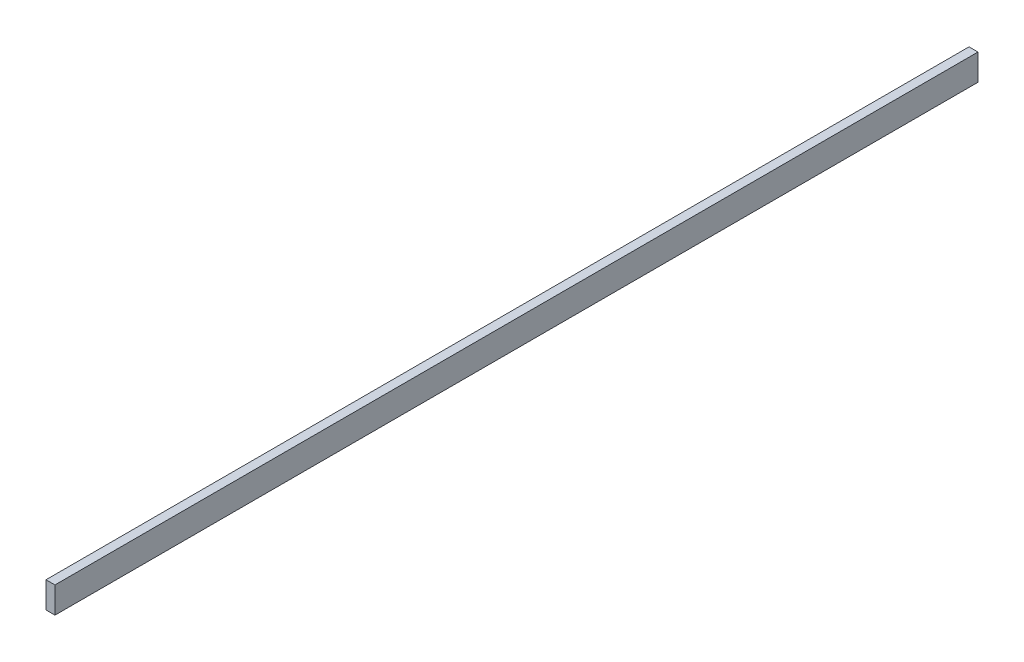
from build123d import *

# Parameters (mm, degrees)
SKETCH1_W           = 12.7
SKETCH1_H           = 37.132967143
BOSS_EXTRUDE1_DEPTH = 1308.1


with BuildPart() as part:
    # Sketch1 → Boss-Extrude1 (new body)
    with BuildSketch(Plane.XY):
        with Locations((6489.18723766, 4635.74128806)):
            Rectangle(SKETCH1_W, SKETCH1_H)
    extrude(amount=BOSS_EXTRUDE1_DEPTH)


solid = part.part
